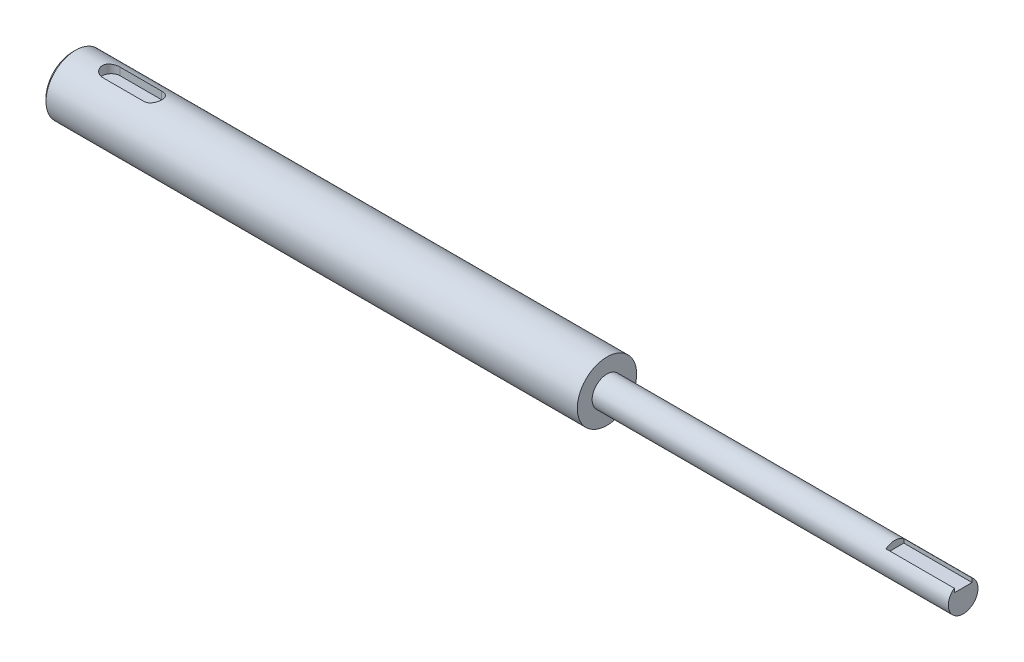
from build123d import *

# Parameters (mm, degrees)
SKETCH_1_R          = 10
EXTRUDE_1_DEPTH     = 150
CUT_EXTRUDE_1_DEPTH = 3
CHAMFER_1_SIZE      = 1
SKETCH_3_R          = 10
EXTRUDE_2_DEPTH     = 150
CUT_EXTRUDE_2_DEPTH = 3
CHAMFER_2_SIZE      = 1
CUT_EXTRUDE_START   = -120
SKETCH_5_R          = 10
SKETCH_5_R_2        = 5
CUT_EXTRUDE_3_DEPTH = 120
SKETCH_6_W          = 6
SKETCH_6_H          = 4.078010131
CUT_EXTRUDE_4_DEPTH = 23


with BuildPart() as part:
    # 草图1 → 凸台-拉伸1 (new body)
    with BuildSketch(Plane(origin=(0, 0, 0), x_dir=(0, 0, -1), z_dir=(1, 0, 0))):
        Circle(SKETCH_1_R)
    extrude(amount=EXTRUDE_1_DEPTH)

    # 草图2 → 切除-拉伸1 (cut)
    with BuildSketch(Plane(origin=(0, 10, 0), x_dir=(1, 0, 0), z_dir=(0, 1, 0))):
        with BuildLine():
            Line((13, 3), (27, 3))
            ThreePointArc((27, 3), (30, 0), (27, -3))
            Line((27, -3), (13, -3))
            ThreePointArc((13, -3), (10, 0), (13, 3))
        make_face()
    extrude(amount=-CUT_EXTRUDE_1_DEPTH, mode=Mode.SUBTRACT)

    # 倒角1
    chamfer_1_edges = [part.edges().sort_by_distance(p)[0] for p in [
        (0, 0, 10),
    ]]
    chamfer(chamfer_1_edges, length=CHAMFER_1_SIZE)

    # 草图3 → 凸台-拉伸2 (add)
    with BuildSketch(Plane(origin=(150, 0, 0), x_dir=(0, 0, -1), z_dir=(1, 0, 0))):
        Circle(SKETCH_3_R)
    extrude(amount=EXTRUDE_2_DEPTH)

    # 草图4 → 切除-拉伸2 (cut)
    with BuildSketch(Plane(origin=(0, 10, 0), x_dir=(1, 0, 0), z_dir=(0, 1, 0))):
        with BuildLine():
            Line((273, 3), (287, 3))
            ThreePointArc((287, 3), (290, 0), (287, -3))
            Line((287, -3), (273, -3))
            ThreePointArc((273, -3), (270, 0), (273, 3))
        make_face()
    extrude(amount=-CUT_EXTRUDE_2_DEPTH, mode=Mode.SUBTRACT)

    # 倒角2
    chamfer_2_edges = [part.edges().sort_by_distance(p)[0] for p in [
        (300, 0, 10),
    ]]
    chamfer(chamfer_2_edges, length=CHAMFER_2_SIZE)

    # 草图5 → 切除-拉伸3 (cut)
    with BuildSketch(Plane(origin=(300, 0, 0), x_dir=(0, 0, -1), z_dir=(1, 0, 0)).offset(CUT_EXTRUDE_START)):
        Circle(SKETCH_5_R)
        Circle(SKETCH_5_R_2, mode=Mode.SUBTRACT)
    extrude(amount=CUT_EXTRUDE_3_DEPTH, mode=Mode.SUBTRACT)

    # 草图6 → 切除-拉伸4 (cut)
    with BuildSketch(Plane(origin=(300, 0, 0), x_dir=(0, 0, -1), z_dir=(1, 0, 0))):
        with Locations((0, 4.709450104)):
            Rectangle(SKETCH_6_W, SKETCH_6_H)
    extrude(amount=-CUT_EXTRUDE_4_DEPTH, mode=Mode.SUBTRACT)


solid = part.part
